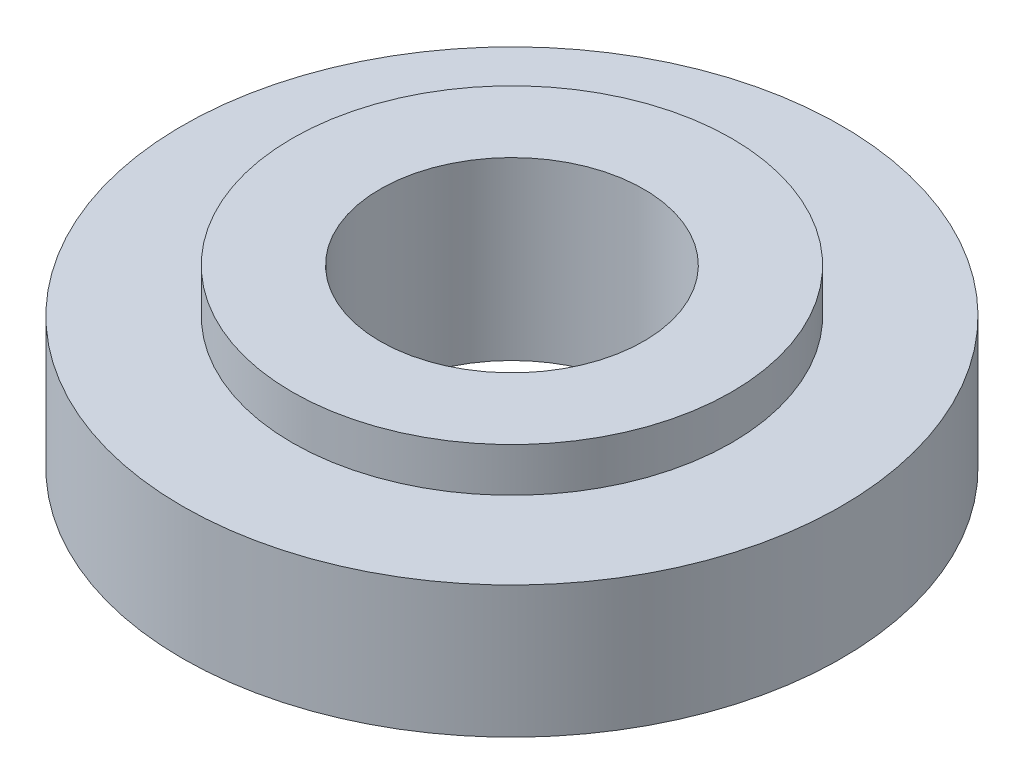
from build123d import *

# Parameters (mm, degrees)
SKETCH1_R           = 3.75
SKETCH1_R_2         = 1.5
BOSS_EXTRUDE1_DEPTH = 1.5
BOSS_EXTRUDE2_START = 0.5
SKETCH1_4_R         = 2.5
SKETCH1_4_R_2       = 1.5
BOSS_EXTRUDE2_DEPTH = 0.5


with BuildPart() as part:
    # Sketch1 → Boss-Extrude1 (new body)
    with BuildSketch(Plane(origin=(0, 0, 0), x_dir=(1, 0, 0), z_dir=(0, 1, 0))):
        Circle(SKETCH1_R)
        Circle(SKETCH1_R_2, mode=Mode.SUBTRACT)
    extrude(amount=-BOSS_EXTRUDE1_DEPTH)

    # Sketch1<4> → Boss-Extrude2 (add)
    with BuildSketch(Plane(origin=(0, 0, 0), x_dir=(1, 0, 0), z_dir=(0, 1, 0)).offset(BOSS_EXTRUDE2_START)):
        Circle(SKETCH1_4_R)
        Circle(SKETCH1_4_R_2, mode=Mode.SUBTRACT)
    extrude(amount=-BOSS_EXTRUDE2_DEPTH)


solid = part.part
